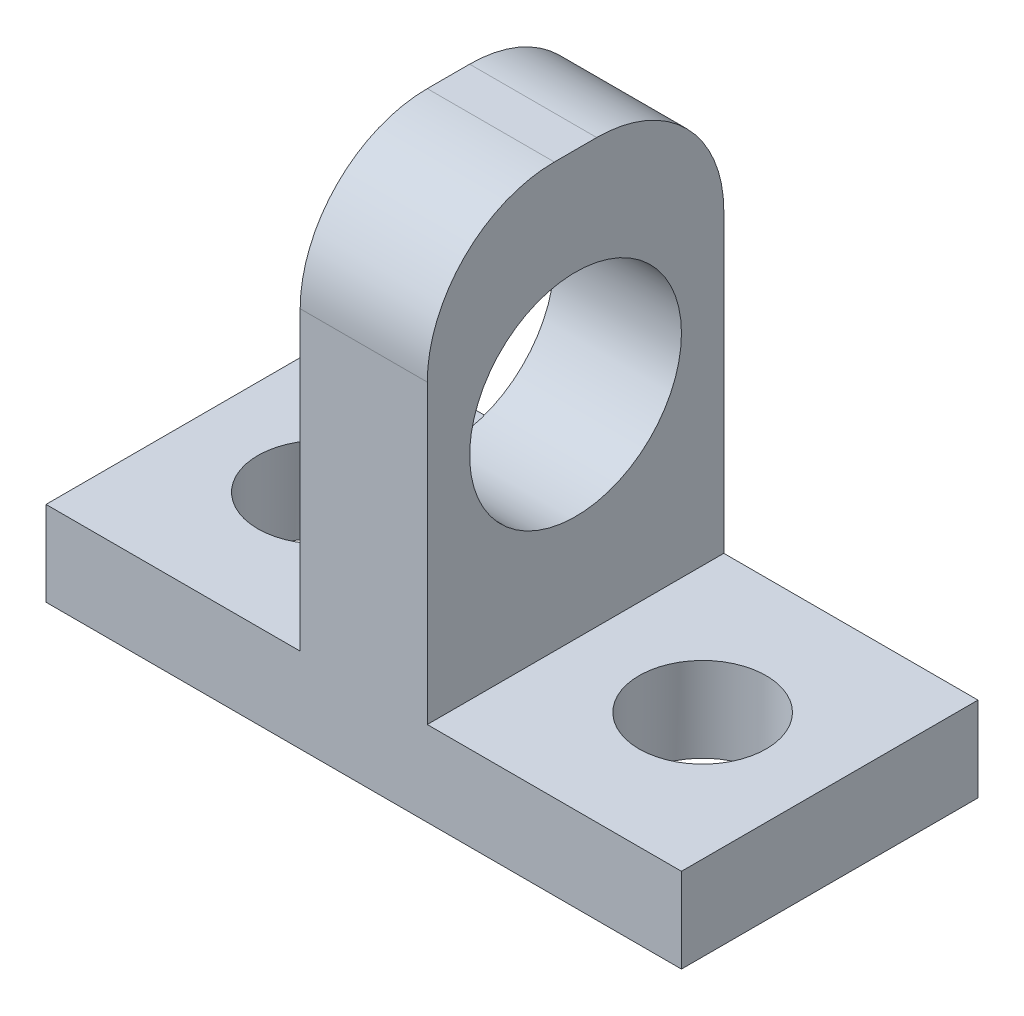
from build123d import *

# Parameters (mm, degrees)
SKETCH1_W           = 15
SKETCH1_H           = 7
BOSS_EXTRUDE1_DEPTH = 2
SKETCH2_W           = 3
SKETCH2_H           = 7
BOSS_EXTRUDE2_DEPTH = 10
SKETCH3_R           = 2.5
CUT_EXTRUDE1_DEPTH  = 10
FILLET1_R           = 3
SKETCH4_R           = 1.5
CUT_EXTRUDE2_DEPTH  = 10


with BuildPart() as part:
    # Sketch1 → Boss-Extrude1 (new body)
    with BuildSketch(Plane(origin=(0, 0, 0), x_dir=(1, 0, 0), z_dir=(0, 1, 0))):
        Rectangle(SKETCH1_W, SKETCH1_H)
    extrude(amount=BOSS_EXTRUDE1_DEPTH)

    # Sketch2 → Boss-Extrude2 (add)
    with BuildSketch(Plane(origin=(0, 2, 0), x_dir=(1, 0, 0), z_dir=(0, 1, 0))):
        Rectangle(SKETCH2_W, SKETCH2_H)
    extrude(amount=BOSS_EXTRUDE2_DEPTH)

    # Sketch3 → Cut-Extrude1 (cut)
    with BuildSketch(Plane(origin=(1.5, 0, 0), x_dir=(0, 0, -1), z_dir=(1, 0, 0))):
        with Locations((0, 7)):
            Circle(SKETCH3_R)
    extrude(amount=-CUT_EXTRUDE1_DEPTH, mode=Mode.SUBTRACT)

    # Fillet1
    fillet1_edges = [part.edges().sort_by_distance(p)[0] for p in [
        (0, 12, 3.5),
        (0, 12, -3.5),
    ]]
    fillet(fillet1_edges, radius=FILLET1_R)

    # Sketch4 → Cut-Extrude2 (cut)
    with BuildSketch(Plane(origin=(0, 2, 0), x_dir=(1, 0, 0), z_dir=(0, 1, 0))):
        with Locations(Location((4.5, 0, 0), (0, 0, 270))):
            Circle(SKETCH4_R)
        with Locations(Location((-4.5, 0, 0), (0, 0, 270))):
            Circle(SKETCH4_R)
    extrude(amount=-CUT_EXTRUDE2_DEPTH, mode=Mode.SUBTRACT)


solid = part.part
